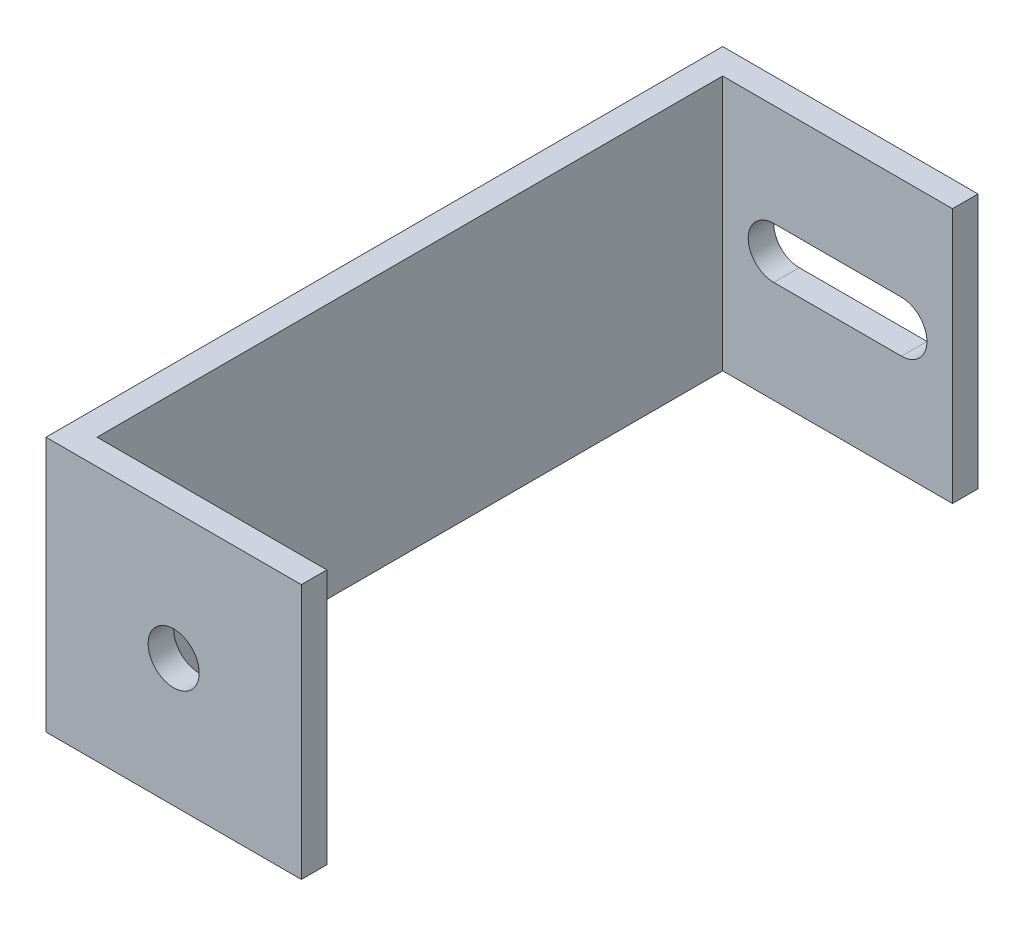
from build123d import *

# Parameters (mm, degrees)
SKETCH1_W           = 20
SKETCH1_H           = 20
BOSS_EXTRUDE1_DEPTH = 2
SKETCH2_W           = 2
SKETCH2_H           = 20
BOSS_EXTRUDE2_DEPTH = 51
SKETCH3_W           = 2
SKETCH3_H           = 20
BOSS_EXTRUDE3_DEPTH = 18
SKETCH4_R           = 2
CUT_EXTRUDE1_DEPTH  = 18
CUT_EXTRUDE2_DEPTH  = 18


with BuildPart() as part:
    # Sketch1 → Boss-Extrude1 (new body)
    with BuildSketch(Plane.XY):
        Rectangle(SKETCH1_W, SKETCH1_H)
    extrude(amount=BOSS_EXTRUDE1_DEPTH)

    # Sketch2 → Boss-Extrude2 (add)
    with BuildSketch(Plane.XY.offset(2)):
        with Locations((-9, 0)):
            Rectangle(SKETCH2_W, SKETCH2_H)
    extrude(amount=BOSS_EXTRUDE2_DEPTH)

    # Sketch3 → Boss-Extrude3 (add)
    with BuildSketch(Plane(origin=(-8, 0, 0), x_dir=(0, 0, -1), z_dir=(1, 0, 0))):
        with Locations((-52, 0)):
            Rectangle(SKETCH3_W, SKETCH3_H)
    extrude(amount=BOSS_EXTRUDE3_DEPTH)

    # Sketch4 → Cut-Extrude1 (cut)
    with BuildSketch(Plane.XY.offset(53)):
        Circle(SKETCH4_R)
    extrude(amount=-CUT_EXTRUDE1_DEPTH, mode=Mode.SUBTRACT)

    # Sketch5 → Cut-Extrude2 (cut)
    with BuildSketch(Plane(origin=(0, 0, 0), x_dir=(-1, 0, 0), z_dir=(0, 0, -1))):
        with BuildLine():
            Line((-6, 2), (4, 2))
            ThreePointArc((4, 2), (6, 0), (4, -2))
            Line((4, -2), (-6, -2))
            ThreePointArc((-6, -2), (-8, 0), (-6, 2))
        make_face()
    extrude(amount=-CUT_EXTRUDE2_DEPTH, mode=Mode.SUBTRACT)


solid = part.part
